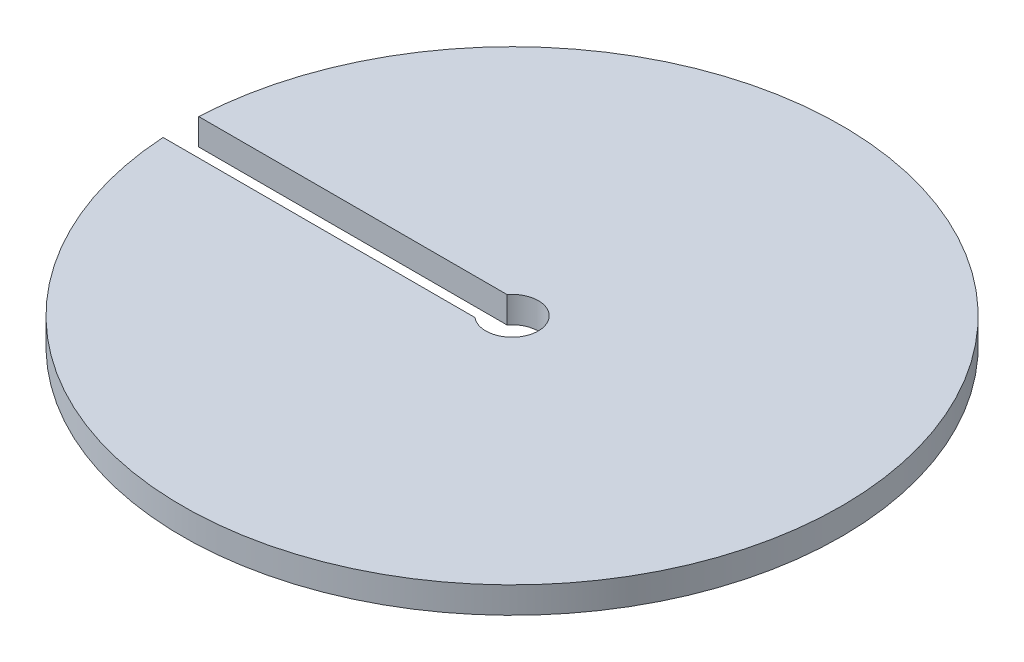
from build123d import *

# Parameters (mm, degrees)
BOSS_EXTRUDE2_DEPTH = 5


with BuildPart() as part:
    # Sketch1 → Boss-Extrude2 (new, symmetric)
    with BuildSketch(Plane(origin=(0, 0, 0), x_dir=(1, 0, 0), z_dir=(0, 1, 0))):
        with BuildLine():
            Line((-6.439098848, -7.598394633), (-124.768843863, -7.598394633))
            ThreePointArc((-124.768843863, -7.598394633), (124.997514219, 0.788314056), (-124.854756061, 6.024108985))
            Line((-124.854756061, 6.024108985), (-7.931437821, 6.024108985))
            ThreePointArc((-7.931437821, 6.024108985), (9.900567269, 1.084602567), (-6.439098848, -7.598394633))
        make_face()
    extrude(amount=BOSS_EXTRUDE2_DEPTH, both=True)


solid = part.part
